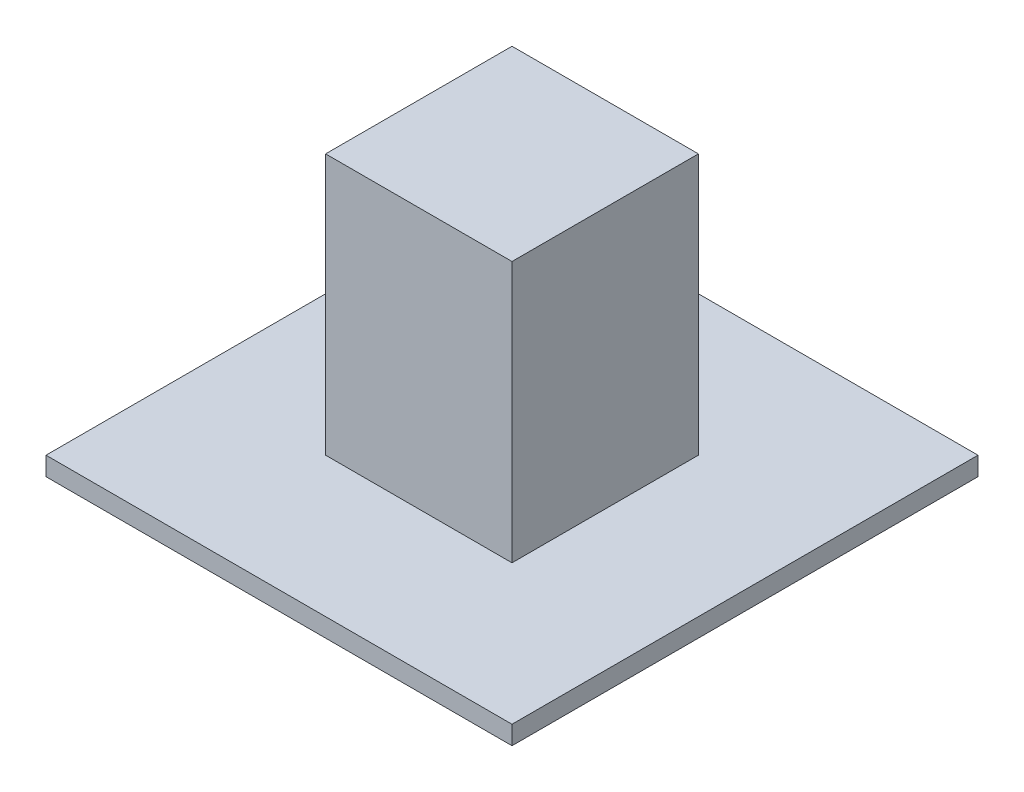
from build123d import *

# Parameters (mm, degrees)
SKETCH1_W           = 2
SKETCH1_H           = 2
BOSS_EXTRUDE1_DEPTH = 2.8
SKETCH2_W           = 5
SKETCH2_H           = 5
BOSS_EXTRUDE2_DEPTH = 0.2
SKETCH3_R           = 0.5
BOSS_EXTRUDE3_DEPTH = 1
SCALE1_SCALE        = 6


with BuildPart() as part:
    # Sketch1 → Boss-Extrude1 (new body)
    with BuildSketch(Plane(origin=(0, 0, 0), x_dir=(1, 0, 0), z_dir=(0, 1, 0))):
        Rectangle(SKETCH1_W, SKETCH1_H)
    extrude(amount=BOSS_EXTRUDE1_DEPTH)

    # Sketch2 → Boss-Extrude2 (add)
    with BuildSketch(Plane(origin=(0, 0, 0), x_dir=(1, 0, 0), z_dir=(0, 1, 0))):
        Rectangle(SKETCH2_W, SKETCH2_H)
    extrude(amount=-BOSS_EXTRUDE2_DEPTH)

    # Sketch3 → Boss-Extrude3 (add)
    with BuildSketch(Plane(origin=(0, -0.2, 0), x_dir=(-1, 0, 0), z_dir=(0, -1, 0))):
        with Locations(Location((0, 0, 0), (0, 0, 90))):
            Circle(SKETCH3_R)
    extrude(amount=BOSS_EXTRUDE3_DEPTH)


with BuildPart() as part_1:
    # Scale1: scaled about (0, 0.861341085, 0)
    add(part.part.scale(SCALE1_SCALE).moved(Location((0, -4.306705425, 0))))


solid = part_1.part
